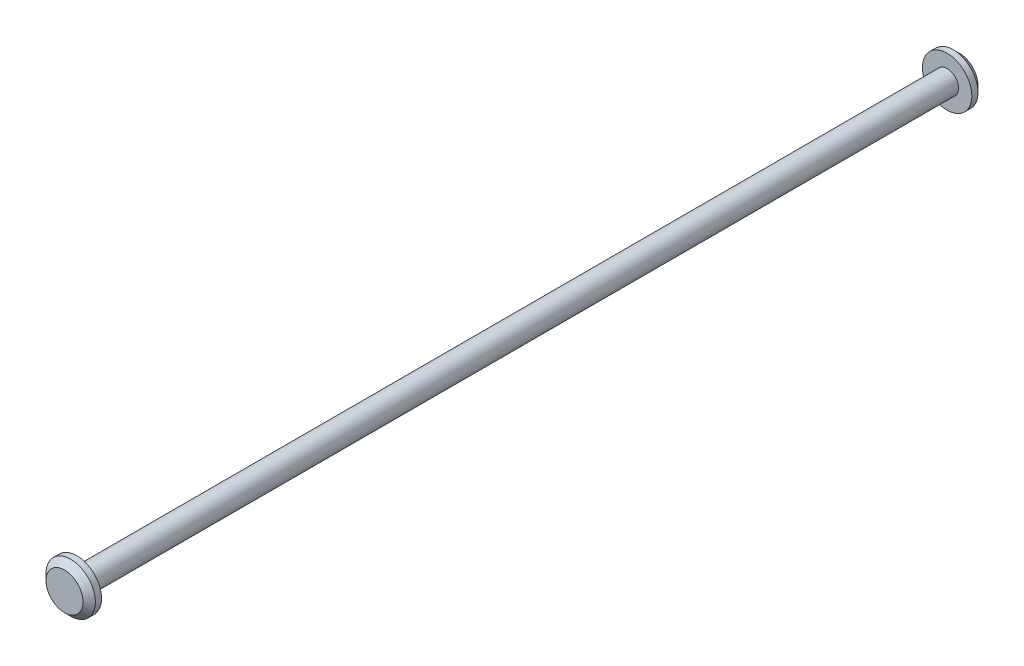
from build123d import *

# Parameters (mm, degrees)
SKETCH1_R           = 0.925
BOSS_EXTRUDE1_DEPTH = 35.25
SKETCH2_R           = 2
BOSS_EXTRUDE2_DEPTH = 1
CHAMFER1_SIZE       = 0.5


with BuildPart() as part:
    # Sketch1 → Boss-Extrude1 (new body)
    with BuildSketch(Plane.XY):
        Circle(SKETCH1_R)
    extrude(amount=BOSS_EXTRUDE1_DEPTH)

    # Sketch2 → Boss-Extrude2 (add)
    with BuildSketch(Plane.XY.offset(35.25)):
        Circle(SKETCH2_R)
    extrude(amount=BOSS_EXTRUDE2_DEPTH)

    # Chamfer1
    chamfer1_edges = [part.edges().sort_by_distance(p)[0] for p in [
        (-2, 0, 36.25),
    ]]
    chamfer(chamfer1_edges, length=CHAMFER1_SIZE)

    # Mirror1: part across plane


with BuildPart() as part_1:
    add(part.part)
    add(part.part.mirror(Plane.XY))


solid = part_1.part
